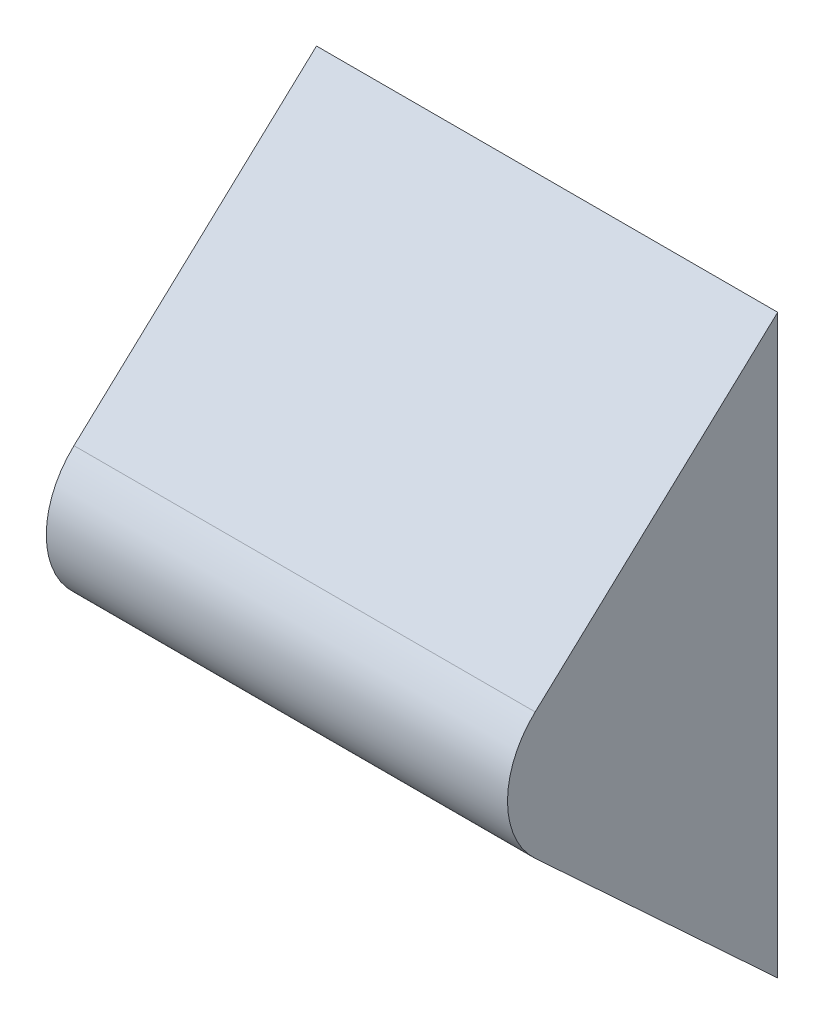
from build123d import *

# Parameters (mm, degrees)
SALIENTE_EXTRUIR1_DEPTH = 40


with BuildPart() as part:
    # Croquis1 → Saliente-Extruir1 (new, symmetric)
    with BuildSketch(Plane(origin=(0, 0, 0), x_dir=(0, -1, 0), z_dir=(1, 0, 0))):
        with BuildLine():
            Line((-11, -10.198039027), (-50, 31.86887196))
            Line((-50, 31.86887196), (50, 31.86887196))
            Line((50, 31.86887196), (11, -10.198039027))
            ThreePointArc((11, -10.198039027), (0, -15), (-11, -10.198039027))
        make_face()
    extrude(amount=SALIENTE_EXTRUIR1_DEPTH, both=True)


solid = part.part
